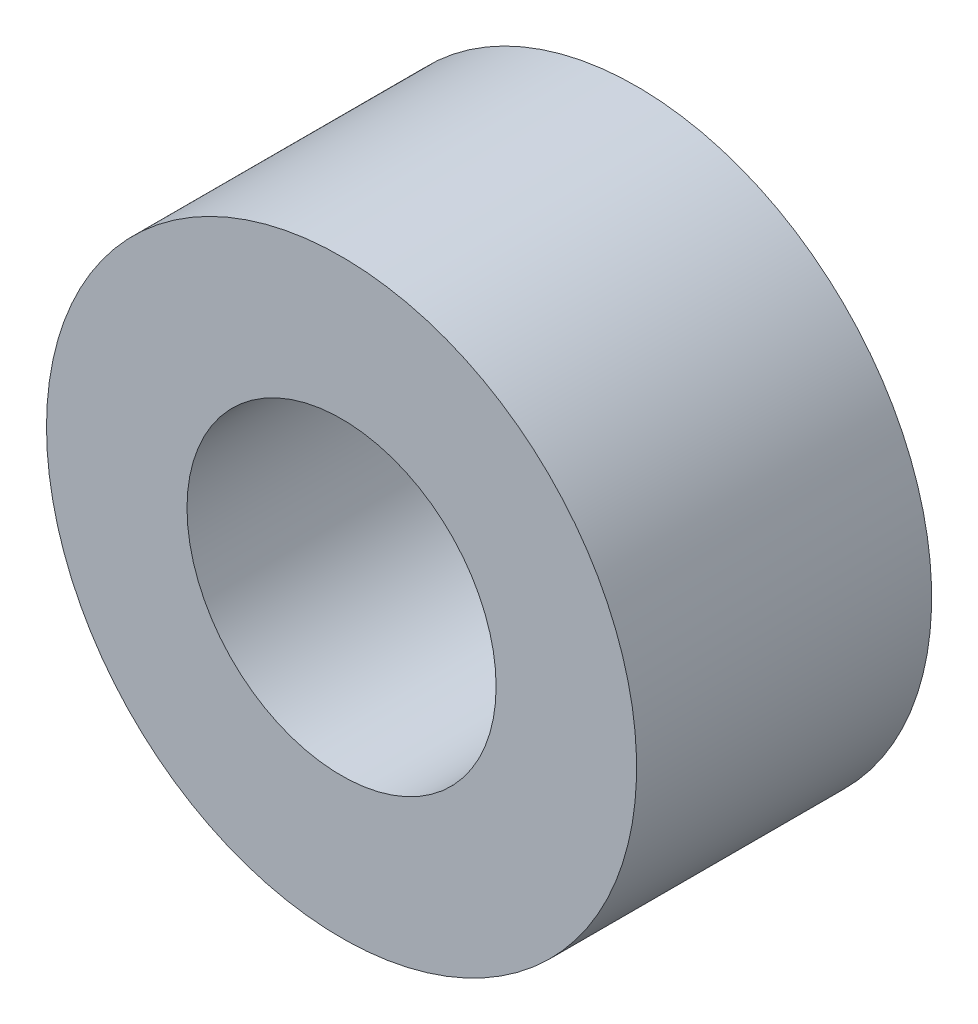
from build123d import *

# Parameters (mm, degrees)
ESQUISSE1_R        = 10.5
ESQUISSE1_R_2      = 5.5
BOSS_EXTRU_1_DEPTH = 10.5


with BuildPart() as part:
    # Esquisse1 → Boss.-Extru.1 (new body)
    with BuildSketch(Plane.XY):
        with Locations(Location((0, 0, 0), (0, 0, 180))):
            Circle(ESQUISSE1_R)
        with Locations(Location((0, 0, 0), (0, 0, 180))):
            Circle(ESQUISSE1_R_2, mode=Mode.SUBTRACT)
    extrude(amount=BOSS_EXTRU_1_DEPTH)


solid = part.part
